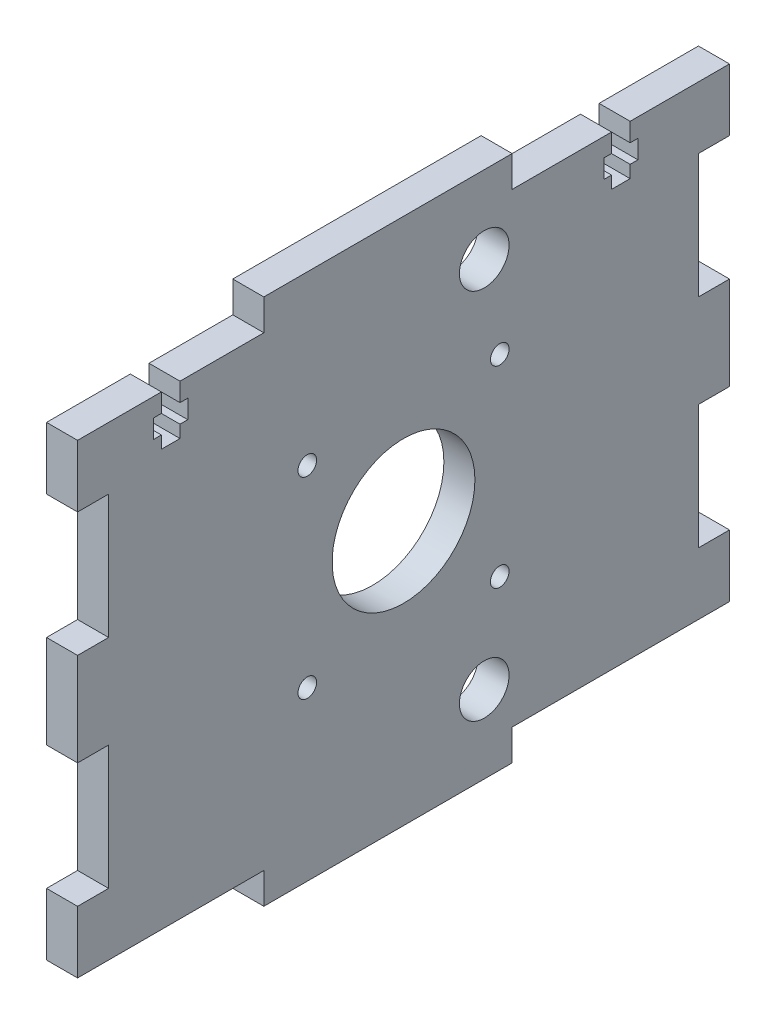
from build123d import *

# Parameters (mm, degrees)
SKETCH_1_R      = 11.5
SKETCH_1_R_2    = 1.5
SKETCH_1_R_3    = 4
EXTRUDE_1_DEPTH = 5


with BuildPart() as part:
    # 草图1 → 凸台-拉伸1 (new body)
    with BuildSketch(Plane(origin=(0, 0, 0), x_dir=(0, 0, -1), z_dir=(1, 0, 0))):
        Polygon((-75, 75), (-88.5, 75), (-88.5, 72), (-87.25, 72), (-87.25, 69), (-88.5, 69), (-88.5, 67), (-91.5, 67), (-91.5, 69), (-92.75, 69), (-92.75, 72), (-91.5, 72), (-91.5, 75), (-105, 75), (-105, 65), (-100, 65), (-100, 45), (-105, 45), (-105, 30), (-100, 30), (-100, 10), (-105, 10), (-105, 0), (-75, 0), (-75, -5), (-35, -5), (-35, 0), (0, 0), (0, 10), (-5, 10), (-5, 30), (0, 30), (0, 45), (-5, 45), (-5, 65), (0, 65), (0, 75), (-16, 75), (-16, 72), (-14.75, 72), (-14.75, 69), (-16, 69), (-16, 67), (-19, 67), (-19, 69), (-20.25, 69), (-20.25, 72), (-19, 72), (-19, 75), (-35, 75), (-35, 80), (-75, 80), align=None)
        with Locations((-52.5, 37.5)):
            Circle(SKETCH_1_R, mode=Mode.SUBTRACT)
        with Locations((-68, 53)):
            Circle(SKETCH_1_R_2, mode=Mode.SUBTRACT)
        with Locations((-37, 53)):
            Circle(SKETCH_1_R_2, mode=Mode.SUBTRACT)
        with Locations((-37, 22)):
            Circle(SKETCH_1_R_2, mode=Mode.SUBTRACT)
        with Locations((-68, 22)):
            Circle(SKETCH_1_R_2, mode=Mode.SUBTRACT)
        with Locations((-39.5, 67.5)):
            Circle(SKETCH_1_R_3, mode=Mode.SUBTRACT)
        with Locations((-39.5, 7.5)):
            Circle(SKETCH_1_R_3, mode=Mode.SUBTRACT)
    extrude(amount=EXTRUDE_1_DEPTH)


solid = part.part
